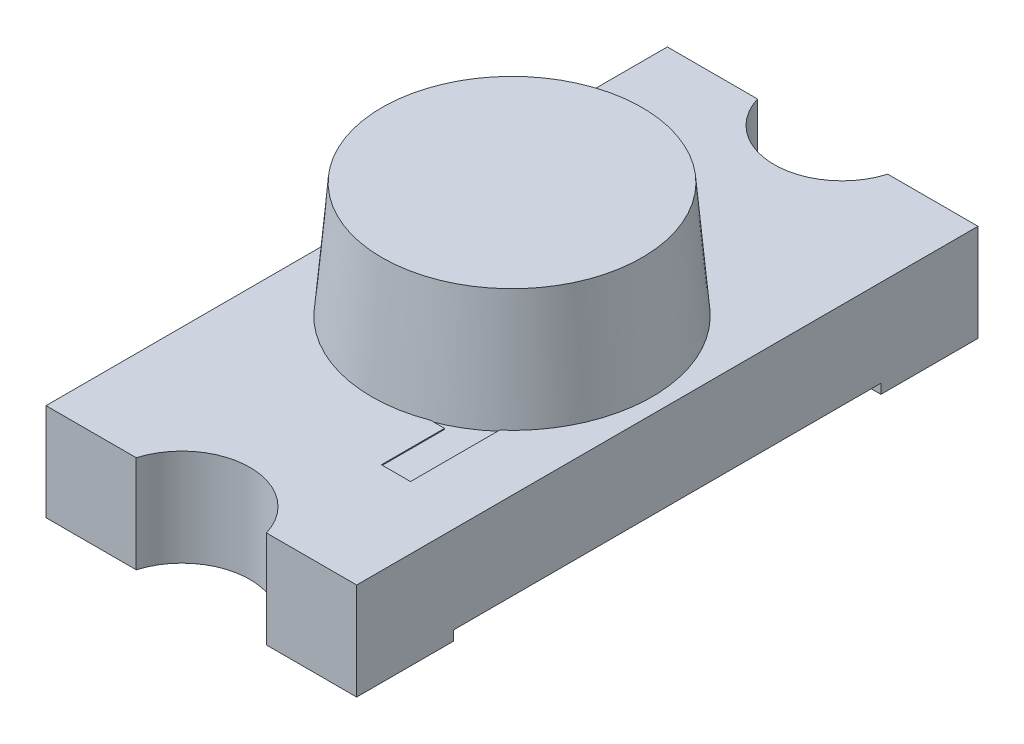
from build123d import *

# Parameters (mm, degrees)
EXTRUDE1_DEPTH      = 0.8
EXTRUDE1_DEPTH_BACK = 0.8
SKETCH2_R           = 0.35
CUT_EXTRUDE1_DEPTH  = 2.857417562
CUT_EXTRUDE2_DEPTH  = 0.005
SKETCH4_W           = 0.39
SKETCH4_H           = 0.39
EXTRUDE2_DEPTH      = 0.25
SKETCH5_R           = 0.722303879
EXTRUDE3_DEPTH      = 0.6
EXTRUDE3_TAPER      = 5


with BuildPart() as part:
    # Sketch1 → Extrude1 (new, two sides: drawn at the far end of the back side and taken through both)
    with BuildSketch(Plane(origin=(0, 0, 0), x_dir=(0, 0, -1), z_dir=(1, 0, 0)).offset(-EXTRUDE1_DEPTH_BACK)):
        Polygon((1.1, 0), (1.6, 0), (1.6, 0.5), (-1.6, 0.5), (-1.6, 0), (-1.1, 0), (-1.1, 0.05), (1.1, 0.05), align=None)
    extrude(amount=EXTRUDE1_DEPTH + EXTRUDE1_DEPTH_BACK)

    # Sketch2 → Cut-Extrude1 (cut, through all)
    with BuildSketch(Plane(origin=(0, 0, 0), x_dir=(1, 0, 0), z_dir=(0, 1, 0))):
        with Locations((0, 1.7)):
            Circle(SKETCH2_R)
        with Locations((0, -1.7)):
            Circle(SKETCH2_R)
    extrude(amount=CUT_EXTRUDE1_DEPTH, mode=Mode.SUBTRACT)

    # Sketch3 → Cut-Extrude2 (cut)
    with BuildSketch(Plane(origin=(0, 0.5, 0), x_dir=(-1, 0, 0), z_dir=(0, 1, 0))):
        Polygon((0.27741461, -1), (0.45741461, -1), (0.45741461, -0.450698672), (-0.276447509, -0.450698672), (-0.276447509, -0.630698672), (0.27741461, -0.630698672), align=None)
        Polygon((-0.225, -0.225), (0.225, -0.225), (0.225, 0.675), (-0.327379025, 0.675), (-0.327379025, 1), (-0.477379025, 1), (-0.477379025, 0.525), (0.075, 0.525), (0.075, 0.225), (-0.225, 0.225), align=None)
    extrude(amount=-CUT_EXTRUDE2_DEPTH, mode=Mode.SUBTRACT)

    # Sketch4 → Extrude2 (add)
    with BuildSketch(Plane(origin=(0, 0.495, 0), x_dir=(-1, 0, 0), z_dir=(0, 1, 0))):
        Rectangle(SKETCH4_W, SKETCH4_H)
    extrude(amount=EXTRUDE2_DEPTH)


with BuildPart() as body_2:
    # Sketch5 → Extrude3 (new body)
    with BuildSketch(Plane(origin=(0, 0.495, 0), x_dir=(-1, 0, 0), z_dir=(0, 1, 0))):
        Circle(SKETCH5_R)
    extrude(amount=EXTRUDE3_DEPTH, taper=EXTRUDE3_TAPER)


solid = Compound([part.part, body_2.part])
